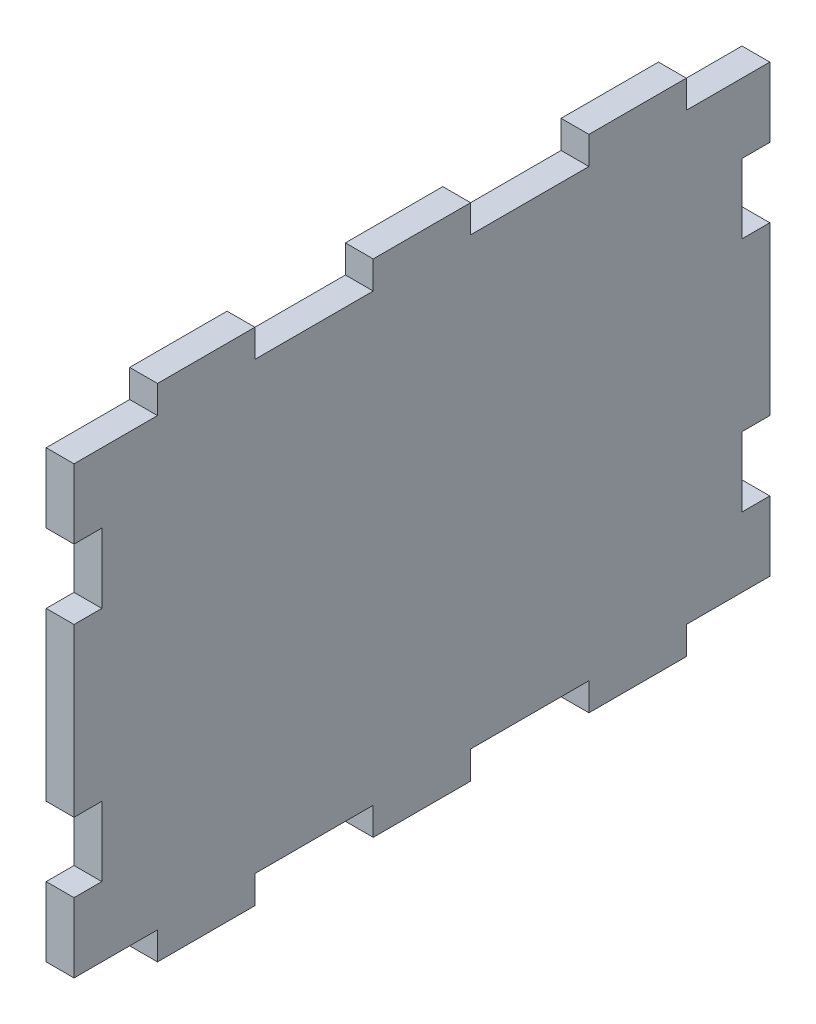
from build123d import *

# Parameters (mm, degrees)
BOSS_EXTRUDE1_DEPTH = 2


with BuildPart() as part:
    # Sketch1 → Boss-Extrude1 (new body)
    with BuildSketch(Plane(origin=(0, 0, 0), x_dir=(0, 0, -1), z_dir=(1, 0, 0))):
        Polygon((-19, 16), (-25, 16), (-25, 11), (-23, 11), (-23, 6), (-25, 6), (-25, -6), (-23, -6), (-23, -11), (-25, -11), (-25, -16), (-19, -16), (-19, -18), (-12, -18), (-12, -16), (-3.5, -16), (-3.5, -18), (3.5, -18), (3.5, -16), (12, -16), (12, -18), (19, -18), (19, -16), (25, -16), (25, -11), (23, -11), (23, -6), (25, -6), (25, 6), (23, 6), (23, 11), (25, 11), (25, 16), (19, 16), (19, 18), (12, 18), (12, 16), (3.5, 16), (3.5, 18), (-3.5, 18), (-3.5, 16), (-12, 16), (-12, 18), (-19, 18), align=None)
    extrude(amount=BOSS_EXTRUDE1_DEPTH)


solid = part.part
